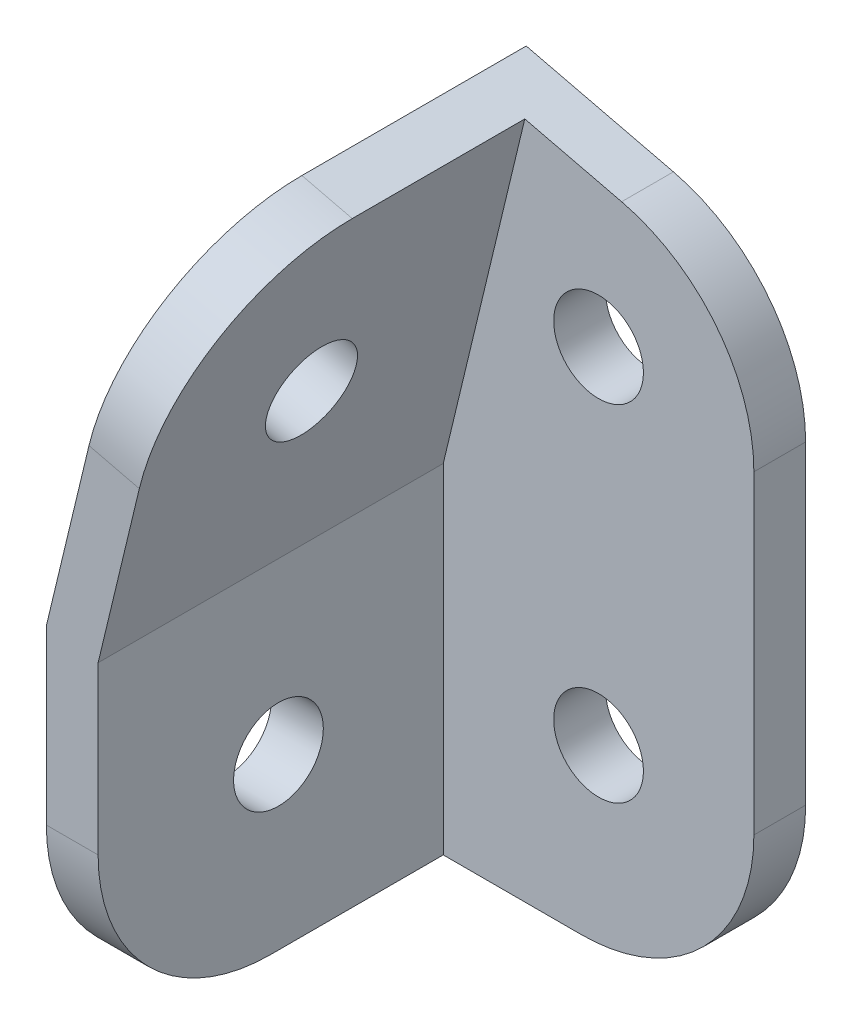
from build123d import *

# Parameters (mm, degrees)
BOSS_EXTRU_1_DEPTH      = 23
ESQUISSE2_R             = 2.6
BOSS_EXTRU_2_DEPTH      = 3
ESQUISSE3_R             = 2.6
ENL_V_MAT_EXTRU_1_DEPTH = 3
ESQUISSE4_R             = 2.6
ENL_V_MAT_EXTRU_2_DEPTH = 3
CONG_1_R                = 10


with BuildPart() as part:
    # Esquisse1 → Boss.-Extru.1 (new body)
    with BuildSketch(Plane.XY):
        Polygon((-100, 325.5), (-100, 305.5), (-97, 305.5), (-97, 325.144463965), (-92.275093963, 344.79877668), (-95.191990577, 345.5), align=None)
    extrude(amount=BOSS_EXTRU_1_DEPTH)

    # Esquisse2 → Boss.-Extru.2 (add)
    with BuildSketch(Plane.XY):
        Polygon((-92.275093963, 344.79877668), (-79, 341.607437837), (-79, 305.5), (-97, 305.5), (-97, 325.144463965), align=None)
        with Locations((-88, 315.5)):
            Circle(ESQUISSE2_R, mode=Mode.SUBTRACT)
        with Locations((-88, 335.5)):
            Circle(ESQUISSE2_R, mode=Mode.SUBTRACT)
    extrude(amount=BOSS_EXTRU_2_DEPTH)

    # Esquisse3 → Enlèv. mat.-Extru.1 (cut)
    with BuildSketch(Plane(origin=(-97, 0, 0), x_dir=(0, 0, -1), z_dir=(1, 0, 0))):
        with Locations((-12.549028202, 315.322231983)):
            Circle(ESQUISSE3_R)
    extrude(amount=-ENL_V_MAT_EXTRU_1_DEPTH, mode=Mode.SUBTRACT)

    # Esquisse4 → Enlèv. mat.-Extru.2 (cut)
    with BuildSketch(Plane(origin=(-165.594765625, 39.809059675, 0), x_dir=(0, 0, -1), z_dir=(0.9722988712431988, -0.23374110673820697, 0))):
        with Locations(Location((-13, 303.571843368, 0), (0, 0, 90))):
            Circle(ESQUISSE4_R)
    extrude(amount=-ENL_V_MAT_EXTRU_2_DEPTH, mode=Mode.SUBTRACT)

    # Congé1
    cong_1_edges = [part.edges().sort_by_distance(p)[0] for p in [
        (-98.5, 305.5, 23),
        (-93.73354227, 345.14938834, 23),
        (-79, 305.5, 1.5),
        (-79, 341.607437837, 1.5),
    ]]
    fillet(cong_1_edges, radius=CONG_1_R)


solid = part.part
